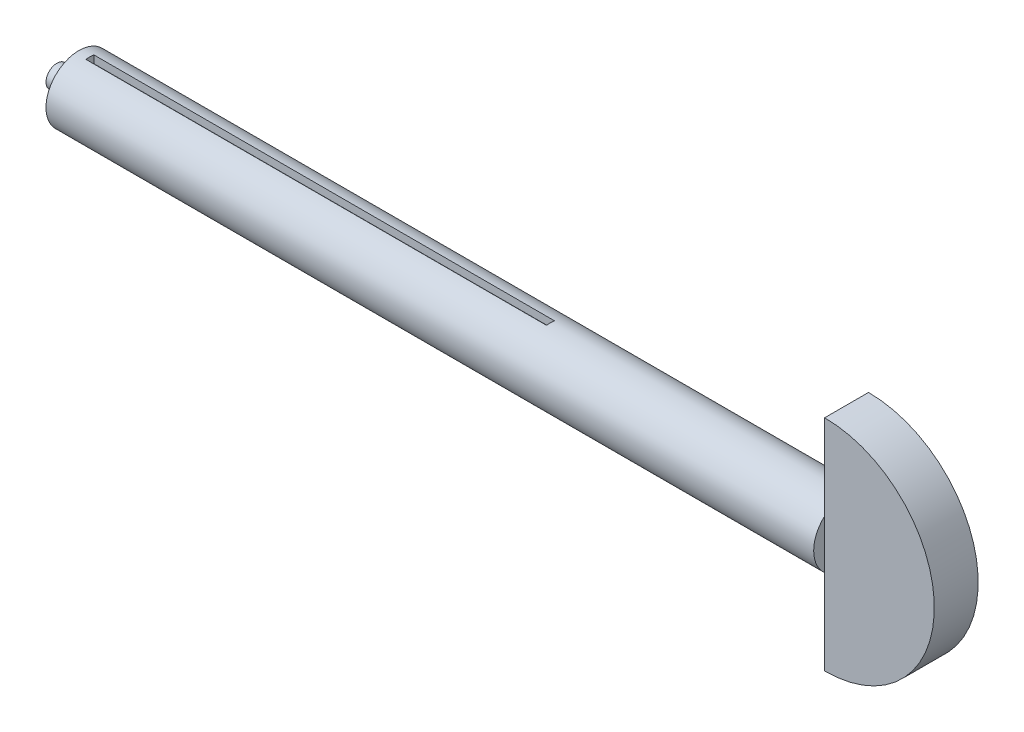
from build123d import *

# Parameters (mm, degrees)
SKETCH1_R           = 2.5
BOSS_EXTRUDE1_DEPTH = 5
SKETCH2_R           = 7.5
BOSS_EXTRUDE2_DEPTH = 175
BOSS_EXTRUDE3_DEPTH = 5
SKETCH4_W           = 105
SKETCH4_H           = 1.8
CUT_EXTRUDE1_DEPTH  = 1.8


with BuildPart() as part:
    # Sketch1 → Boss-Extrude1 (new body)
    with BuildSketch(Plane(origin=(0, 0, 0), x_dir=(0, 0, -1), z_dir=(1, 0, 0))):
        Circle(SKETCH1_R)
    extrude(amount=BOSS_EXTRUDE1_DEPTH)

    # Sketch2 → Boss-Extrude2 (add)
    with BuildSketch(Plane(origin=(5, 0, 0), x_dir=(0, 0, -1), z_dir=(1, 0, 0))):
        Circle(SKETCH2_R)
    extrude(amount=BOSS_EXTRUDE2_DEPTH)

    # Sketch3 → Boss-Extrude3 (add, symmetric)
    with BuildSketch(Plane.XY):
        with BuildLine():
            Line((180, -25), (180, 25))
            ThreePointArc((180, 25), (205, 0), (180, -25))
        make_face()
    extrude(amount=BOSS_EXTRUDE3_DEPTH, both=True)

    # Sketch4 → Cut-Extrude1 (cut)
    with BuildSketch(Plane(origin=(0, 5.7, 0), x_dir=(1, 0, 0), z_dir=(0, 1, 0))):
        with Locations((60, 0)):
            Rectangle(SKETCH4_W, SKETCH4_H)
    cut_extrude1 = extrude(amount=CUT_EXTRUDE1_DEPTH, mode=Mode.SUBTRACT)

    # Mirror1: Cut-Extrude1 across plane
    add(cut_extrude1.mirror(Plane.ZX), mode=Mode.SUBTRACT)


solid = part.part
